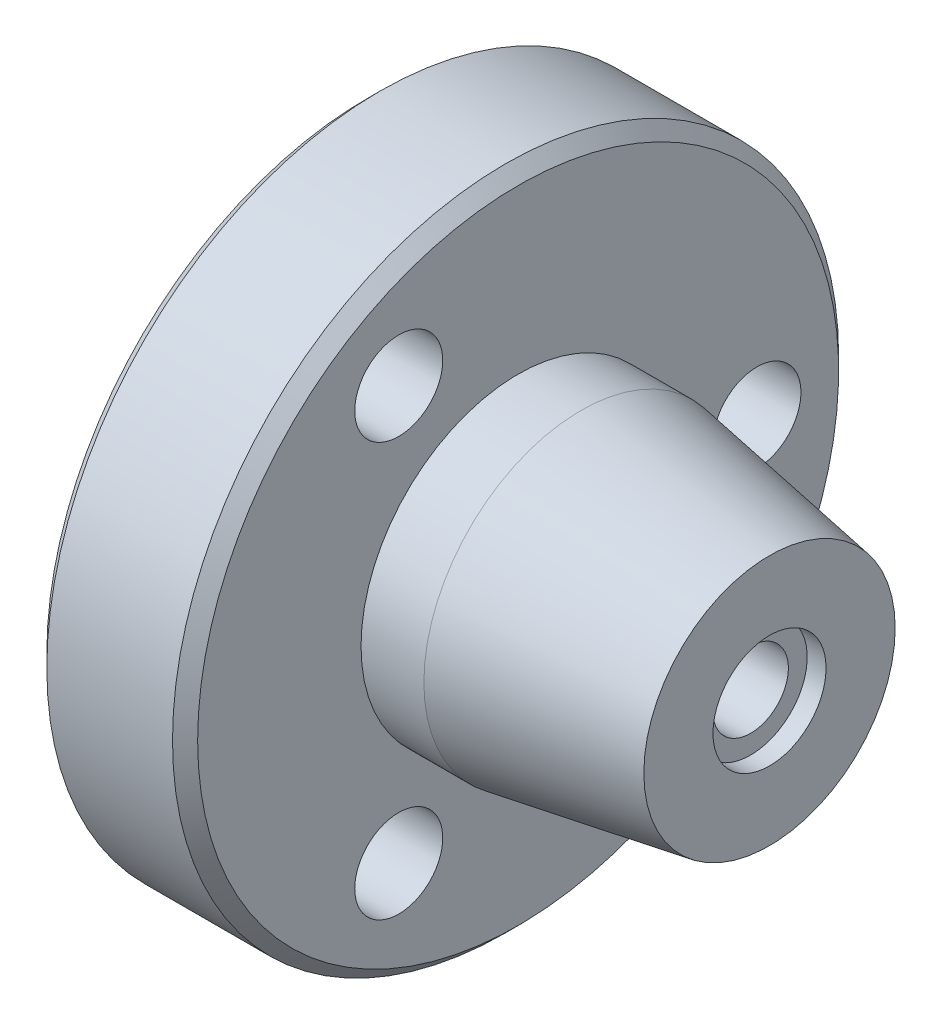
from build123d import *

# Parameters (mm, degrees)
SKETCH_2_R          = 3.5
CUT_EXTRUDE_1_DEPTH = 55.813319549


with BuildPart() as part:
    # 草图1 → 旋转1 (revolve)
    with BuildSketch(Plane.XY, mode=Mode.PRIVATE) as revolve_1_sk:
        Polygon((0, 11.5), (1, 12.5), (8, 12.5), (8, 25.5), (9, 26.5), (19, 26.5), (20, 25.5), (20, 12.5), (25, 12.5), (40, 10), (40, 4.5), (38.5, 4.5), (38.5, 3), (1.5, 3), (1.5, 4.5), (0, 4.5), align=None)
    revolve(revolve_1_sk.sketch.rotate(Axis((0, 0, 0), (1, 0, 0)), 90), axis=Axis((0, 0, 0), (1, 0, 0)))

    # 草图2 → 切除-拉伸1 (cut, through all)
    with BuildSketch(Plane(origin=(0, 0, 0), x_dir=(0, 0, -1), z_dir=(1, 0, 0))):
        with Locations(Location((19, 0, 0), (0, 0, 180))):
            Circle(SKETCH_2_R)
        with Locations(Location((-9.5, 16.454482672, 0), (0, 0, 180))):
            Circle(SKETCH_2_R)
        with Locations(Location((-9.5, -16.454482672, 0), (0, 0, 180))):
            Circle(SKETCH_2_R)
    extrude(amount=CUT_EXTRUDE_1_DEPTH, mode=Mode.SUBTRACT)


solid = part.part
